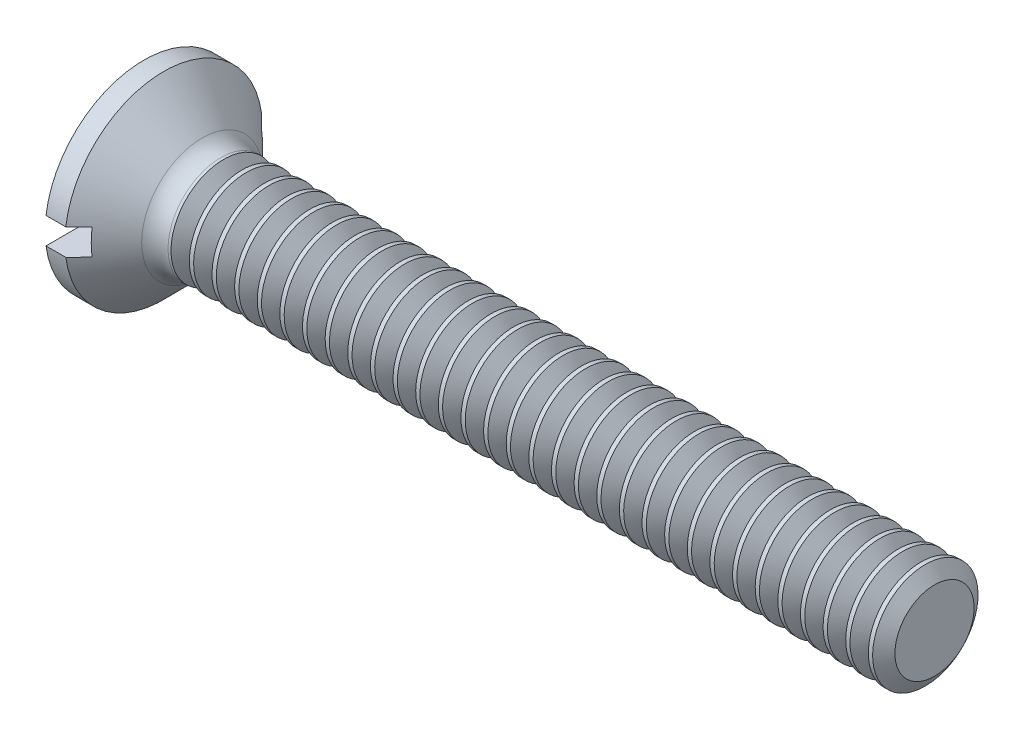
from build123d import *

# Parameters (mm, degrees)
FILLET1_R       = 0.4
SKETCH2_W       = 3
SKETCH2_H       = 0.4
SLOT_DEPTH      = 0.5
THDSCHPAT_COUNT = 32
THDSCHPAT_PITCH = 0.343548387


with BuildPart() as part:
    # BodySke → Base-Revolve (revolve)
    with BuildSketch(Plane.XY, mode=Mode.PRIVATE) as base_revolve_sk:
        Polygon((0, 0), (0, 1.5), (0.3, 1.5), (1, 0.8), (12, 0.8), (12, 0), align=None)
    revolve(base_revolve_sk.sketch.rotate(Axis((-6.35, 0, 0), (1, 0, 0)), 90), axis=Axis((-6.35, 0, 0), (1, 0, 0)))

    # Fillet1
    fillet1_edges = [part.edges().sort_by_distance(p)[0] for p in [
        (1, 0, -0.8),
    ]]
    fillet(fillet1_edges, radius=FILLET1_R)

    # Sketch2 → Slot (cut)
    with BuildSketch(Plane.ZY):
        Rectangle(SKETCH2_W, SKETCH2_H)
    extrude(amount=-SLOT_DEPTH, mode=Mode.SUBTRACT)

    # ThdSchSke → ThreadSchematic (revolve, cut)
    with BuildSketch(Plane.XY, mode=Mode.PRIVATE) as threadschematic_sk:
        Polygon((1.350001, -0.601), (1.2106597, -0.8), (1.2106597, -1), (1.4893423, -1), (1.4893423, -0.8), align=None)
    threadschematic = revolve(threadschematic_sk.sketch.rotate(Axis((-3.175, 0, 0), (1, 0, 0)), 270), axis=Axis((-3.175, 0, 0), (1, 0, 0)), mode=Mode.SUBTRACT)

    # ThdSchPat: ThreadSchematic ×32
    with Locations(*[(i * THDSCHPAT_PITCH, 0, 0) for i in range(1, THDSCHPAT_COUNT)]):
        add(threadschematic, mode=Mode.SUBTRACT)


solid = part.part
